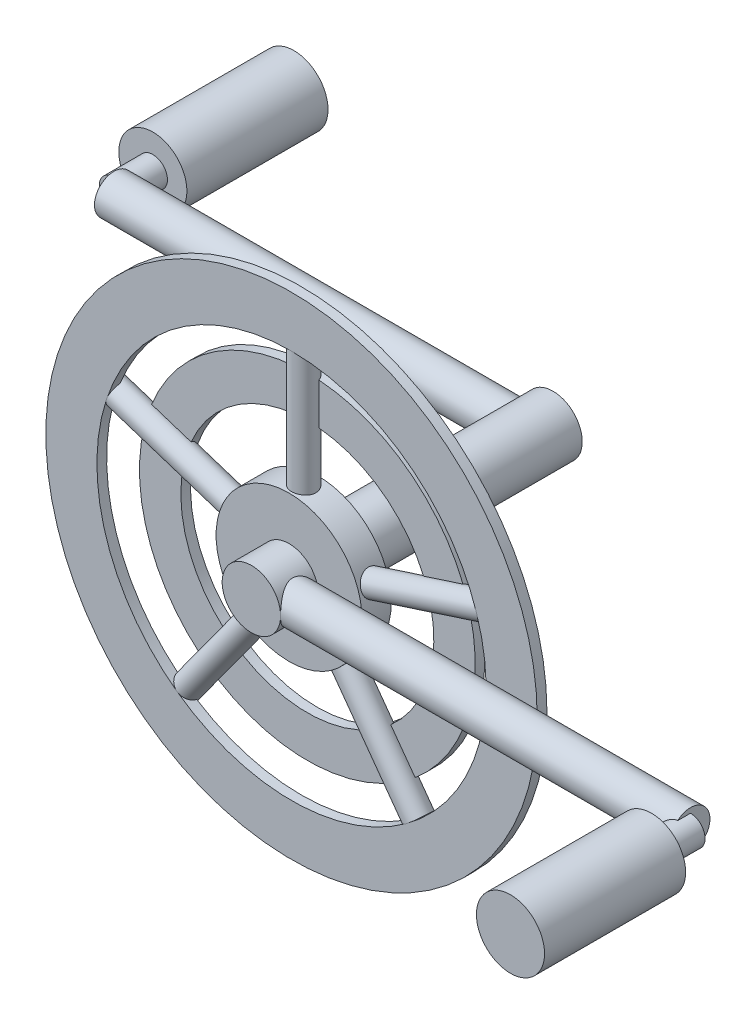
from build123d import *

# Parameters (mm, degrees)
EJE_PEDALIER_PROFILE_R   = 12
ARANA_CENTRO_PROFILE_R   = 30
BRAZO_ARANA_PROFILE_R    = 5
MATRIZ_BRAZOS_COUNT      = 5
PLATO_GRANDE_START       = 41.5
SK_PLATO_GRANDE_R        = 101
SK_PLATO_GRANDE_R_2      = 80
PLATO_GRANDE_DEPTH       = 4
PLATO_PEQUENO_START      = 35
SK_PLATO_PEQUENO_R       = 69
SK_PLATO_PEQUENO_R_2     = 52
PLATO_PEQUENO_DEPTH      = 4
BIELA_DCHA_PROFILE_R     = 8
BIELA_IZQ_PROFILE_R      = 8
EJE_PEDAL_DCHO_PROFILE_R = 6
EJE_PEDAL_IZQ_PROFILE_R  = 6
PEDAL_DCHO_PROFILE_R     = 14
PEDAL_IZQ_PROFILE_R      = 14


with BuildPart() as part:
    # Eje_pedalier: sweep along a curve in space
    with BuildLine() as eje_pedalier_path:
        Line((0, 0, -62), (0, 0, 62))
    # Eje_pedalier profile (on start of the path) → Eje_pedalier (sweep)
    with BuildSketch(Plane.XY.offset(-62)):
        Circle(EJE_PEDALIER_PROFILE_R)
    sweep(path=eje_pedalier_path.line)

    # Arana_centro: sweep along a curve in space
    with BuildLine() as arana_centro_path:
        Line((0, 0, 34.5), (0, 0, 46.5))
    # Arana_centro profile (on start of the path) → Arana_centro (sweep)
    with BuildSketch(Plane.XY.offset(34.5)):
        Circle(ARANA_CENTRO_PROFILE_R)
    sweep(path=arana_centro_path.line)

    # Brazo_arana: sweep along a curve in space
    with BuildLine() as brazo_arana_path:
        Line((0, 0, 40.5), (0, 90, 40.5))
    # Brazo_arana profile (on start of the path) → Brazo_arana (sweep)
    with BuildSketch(Plane(origin=(0, 0, 40.5), x_dir=(0, 0, 1), z_dir=(0, 1, 0))):
        Circle(BRAZO_ARANA_PROFILE_R)
    brazo_arana = sweep(path=brazo_arana_path.line)

    # Matriz_brazos: Brazo_arana ×5 about axis
    matriz_brazos_axis = Axis((0, 0, -62), (0, 0, 1))
    for i in range(1, MATRIZ_BRAZOS_COUNT):
        add(brazo_arana.rotate(matriz_brazos_axis, i * 360 / MATRIZ_BRAZOS_COUNT))

    # Sk_Plato_grande → Plato_grande (add)
    with BuildSketch(Plane.XY.offset(PLATO_GRANDE_START)):
        Circle(SK_PLATO_GRANDE_R)
        Circle(SK_PLATO_GRANDE_R_2, mode=Mode.SUBTRACT)
    extrude(amount=PLATO_GRANDE_DEPTH)

    # Sk_Plato_pequeno → Plato_pequeno (add)
    with BuildSketch(Plane.XY.offset(PLATO_PEQUENO_START)):
        Circle(SK_PLATO_PEQUENO_R)
        Circle(SK_PLATO_PEQUENO_R_2, mode=Mode.SUBTRACT)
    extrude(amount=PLATO_PEQUENO_DEPTH)

    # Biela_dcha: sweep along a curve in space
    with BuildLine() as biela_dcha_path:
        Line((0, 0, 54), (172.5, 0, 54))
    # Biela_dcha profile (on start of the path) → Biela_dcha (sweep)
    with BuildSketch(Plane(origin=(0, 0, 54), x_dir=(0, 0, 1), z_dir=(1, 0, 0))):
        Circle(BIELA_DCHA_PROFILE_R)
    sweep(path=biela_dcha_path.line)

    # Biela_izq: sweep along a curve in space
    with BuildLine() as biela_izq_path:
        Line((0, 0, -54), (-172.5, 0, -54))
    # Biela_izq profile (on start of the path) → Biela_izq (sweep)
    with BuildSketch(Plane(origin=(0, 0, -54), x_dir=(0, 0, -1), z_dir=(-1, 0, 0))):
        Circle(BIELA_IZQ_PROFILE_R)
    sweep(path=biela_izq_path.line)

    # Eje_pedal_dcho: sweep along a curve in space
    with BuildLine() as eje_pedal_dcho_path:
        Line((172.5, 0, 54), (172.5, 0, 75))
    # Eje_pedal_dcho profile (on start of the path) → Eje_pedal_dcho (sweep)
    with BuildSketch(Plane(origin=(172.5, 0, 54), x_dir=(1, 0, 0), z_dir=(0, 0, 1))):
        Circle(EJE_PEDAL_DCHO_PROFILE_R)
    sweep(path=eje_pedal_dcho_path.line)

    # Eje_pedal_izq: sweep along a curve in space
    with BuildLine() as eje_pedal_izq_path:
        Line((-172.5, 0, -54), (-172.5, 0, -75))
    # Eje_pedal_izq profile (on start of the path) → Eje_pedal_izq (sweep)
    with BuildSketch(Plane(origin=(-172.5, 0, -54), x_dir=(-1, 0, 0), z_dir=(0, 0, -1))):
        Circle(EJE_PEDAL_IZQ_PROFILE_R)
    sweep(path=eje_pedal_izq_path.line)

    # Pedal_dcho: sweep along a curve in space
    with BuildLine() as pedal_dcho_path:
        Line((172.5, 0, 70), (172.5, 0, 128))
    # Pedal_dcho profile (on start of the path) → Pedal_dcho (sweep)
    with BuildSketch(Plane(origin=(172.5, 0, 70), x_dir=(1, 0, 0), z_dir=(0, 0, 1))):
        Circle(PEDAL_DCHO_PROFILE_R)
    sweep(path=pedal_dcho_path.line)

    # Pedal_izq: sweep along a curve in space
    with BuildLine() as pedal_izq_path:
        Line((-172.5, 0, -128), (-172.5, 0, -70))
    # Pedal_izq profile (on start of the path) → Pedal_izq (sweep)
    with BuildSketch(Plane(origin=(-172.5, 0, -128), x_dir=(1, 0, 0), z_dir=(0, 0, 1))):
        Circle(PEDAL_IZQ_PROFILE_R)
    sweep(path=pedal_izq_path.line)


solid = part.part
